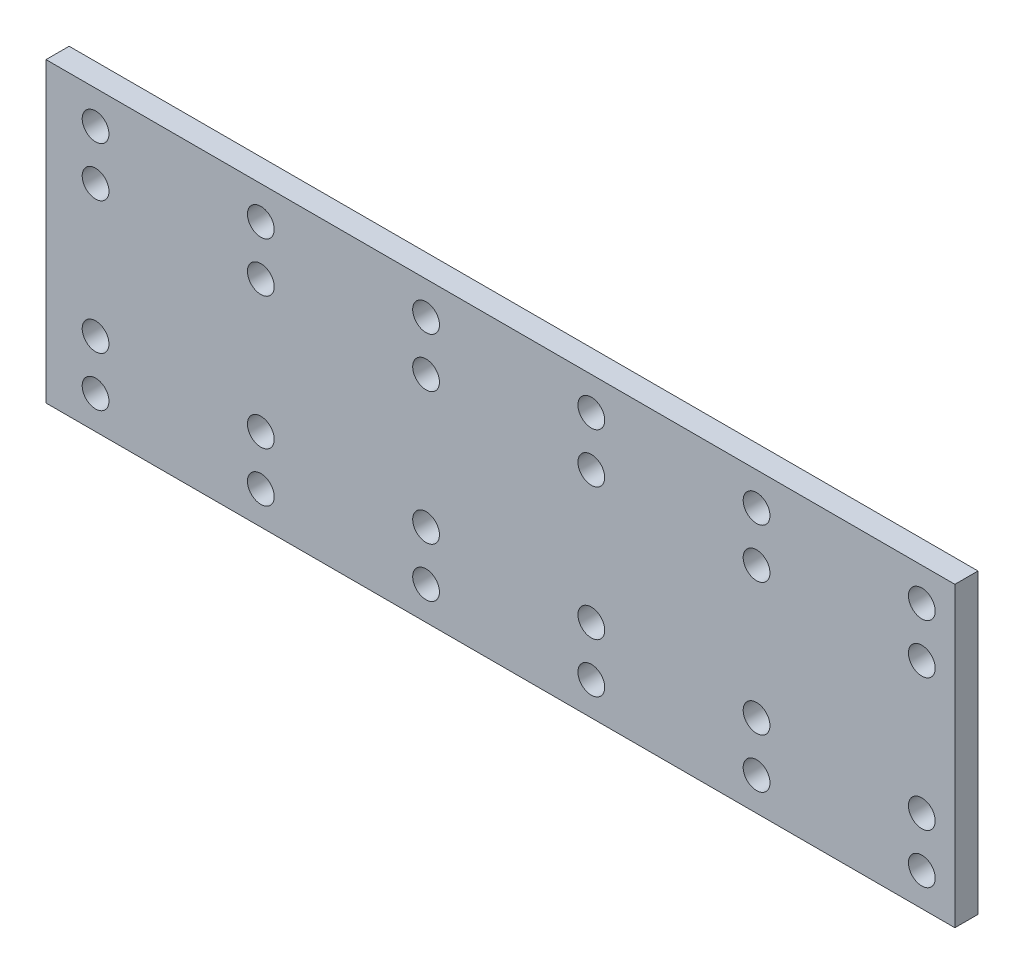
from build123d import *

# Parameters (mm, degrees)
SKETCH1_W           = 275
SKETCH1_H           = 90
BOSS_EXTRUDE1_DEPTH = 7
SKETCH2_R           = 4.05
CUT_EXTRUDE1_DEPTH  = 10


with BuildPart() as part:
    # Sketch1 → Boss-Extrude1 (new body)
    with BuildSketch(Plane.XY):
        with Locations((137.5, 45)):
            Rectangle(SKETCH1_W, SKETCH1_H)
    extrude(amount=BOSS_EXTRUDE1_DEPTH)

    # Sketch2 → Cut-Extrude1 (cut)
    with BuildSketch(Plane.XY.offset(7)):
        with Locations((265, 65)):
            Circle(SKETCH2_R)
        with Locations((265, 25)):
            Circle(SKETCH2_R)
        with Locations((215, 65)):
            Circle(SKETCH2_R)
        with Locations((215, 25)):
            Circle(SKETCH2_R)
        with Locations((165, 65)):
            Circle(SKETCH2_R)
        with Locations((165, 25)):
            Circle(SKETCH2_R)
        with Locations((115, 65)):
            Circle(SKETCH2_R)
        with Locations((115, 25)):
            Circle(SKETCH2_R)
        with Locations((65, 65)):
            Circle(SKETCH2_R)
        with Locations((65, 25)):
            Circle(SKETCH2_R)
        with Locations((265, 80)):
            Circle(SKETCH2_R)
        with Locations((265, 10)):
            Circle(SKETCH2_R)
        with Locations((215, 80)):
            Circle(SKETCH2_R)
        with Locations((215, 10)):
            Circle(SKETCH2_R)
        with Locations((165, 80)):
            Circle(SKETCH2_R)
        with Locations((165, 10)):
            Circle(SKETCH2_R)
        with Locations((115, 80)):
            Circle(SKETCH2_R)
        with Locations((115, 10)):
            Circle(SKETCH2_R)
        with Locations((65, 80)):
            Circle(SKETCH2_R)
        with Locations((65, 10)):
            Circle(SKETCH2_R)
        with Locations((15, 80)):
            Circle(SKETCH2_R)
        with Locations((15, 25)):
            Circle(SKETCH2_R)
        with Locations((15, 10)):
            Circle(SKETCH2_R)
        with Locations((15, 65)):
            Circle(SKETCH2_R)
    extrude(amount=-CUT_EXTRUDE1_DEPTH, mode=Mode.SUBTRACT)


solid = part.part
